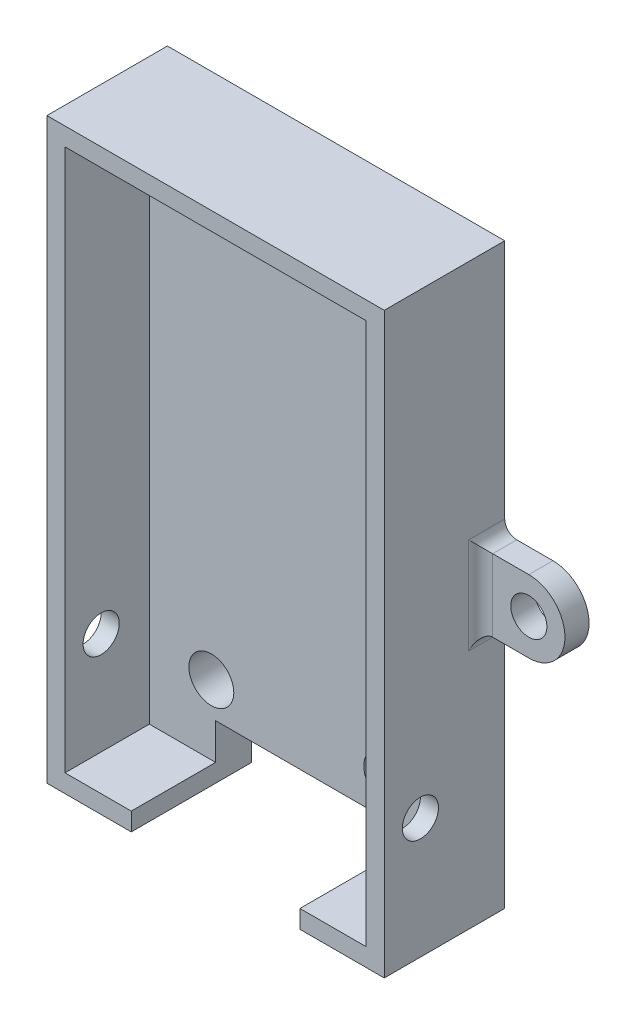
from build123d import *

# Parameters (mm, degrees)
ESQUISSE1_W                  = 25
ESQUISSE1_H                  = 45
ESQUISSE1_R                  = 1.863501178
ESQUISSE1_R_2                = 1.93430269
ESQUISSE1_R_3                = 1.939737899
ESQUISSE1_R_4                = 1.854627201
BOSS_EXTRU_1_DEPTH           = 3
BOSS_EXTRU_2_DEPTH           = 10
ENL_V_MAT_EXTRU_1_DEPTH      = 30.52964612
ENL_V_MAT_EXTRU_1_DEPTH_BACK = 30.52964612
ESQUISSE3_R                  = 1.5
ESQUISSE4_R                  = 1.5
BOSS_EXTRU_3_DEPTH           = 2
CONG_1_R                     = 1
ESQUISSE5_W                  = 14
ESQUISSE5_H                  = 3
ENL_V_MAT_EXTRU_2_DEPTH      = 34.421549934


with BuildPart() as part:
    # Esquisse1 → Boss.-Extru.1 (new body)
    with BuildSketch(Plane.XY):
        Rectangle(ESQUISSE1_W, ESQUISSE1_H)
        with Locations((-7.354431697, -16.736502833)):
            Circle(ESQUISSE1_R, mode=Mode.SUBTRACT)
        with Locations((7.237211302, -16.593743463)):
            Circle(ESQUISSE1_R_2, mode=Mode.SUBTRACT)
        with Locations((-7.142905367, 18.055953642)):
            Circle(ESQUISSE1_R_3, mode=Mode.SUBTRACT)
        with Locations((7.324743745, 18.008545284)):
            Circle(ESQUISSE1_R_4, mode=Mode.SUBTRACT)
    extrude(amount=BOSS_EXTRU_1_DEPTH)

    # Esquisse2 → Boss.-Extru.2 (add)
    with BuildSketch(Plane.XY):
        Polygon((7, -22.5), (7, -24), (14, -24), (14, 24), (-14, 24), (-14, -24), (-7, -24), (-7, -22.5), (-12.5, -22.5), (-12.5, 22.5), (12.5, 22.5), (12.5, -22.5), align=None)
    extrude(amount=BOSS_EXTRU_2_DEPTH)

    # Esquisse3 → Enlèv. mat.-Extru.1 (cut, two sides: drawn at the far end of the back side and taken through both)
    with BuildSketch(Plane(origin=(0, 0, 0), x_dir=(0, 0, -1), z_dir=(1, 0, 0)).offset(-ENL_V_MAT_EXTRU_1_DEPTH_BACK)):
        with Locations((-7, -14)):
            Circle(ESQUISSE3_R)
    extrude(amount=ENL_V_MAT_EXTRU_1_DEPTH + ENL_V_MAT_EXTRU_1_DEPTH_BACK, mode=Mode.SUBTRACT)

    # Esquisse4 → Boss.-Extru.3 (add)
    # profile 1 of 2: a face of its own
    with BuildSketch(Plane.XY):
        with BuildLine():
            Line((-14, 3), (-18, 3))
            ThreePointArc((-18, 3), (-21, 0), (-18, -3))
            Line((-18, -3), (-14, -3))
            Line((-14, -3), (-14, 3))
        make_face()
        with Locations((-18, 0)):
            Circle(ESQUISSE4_R, mode=Mode.SUBTRACT)
    # profile 2 of 2: a face of its own
    with BuildSketch(Plane.XY):
        with BuildLine():
            Line((18, -3), (14, -3))
            Line((14, -3), (14, 3))
            Line((14, 3), (18, 3))
            ThreePointArc((18, 3), (21, 0), (18, -3))
        make_face()
        with Locations(Location((18, 0, 0), (0, 0, 180))):
            Circle(ESQUISSE4_R, mode=Mode.SUBTRACT)
    extrude(amount=BOSS_EXTRU_3_DEPTH)

    # Congé1
    cong_1_edges = [part.edges().sort_by_distance(p)[0] for p in [
        (-14, 0, 2),
        (-14, -3, 1),
        (-14, 3, 1),
        (14, 0, 2),
        (14, 3, 1),
        (14, -3, 1),
    ]]
    fillet(cong_1_edges, radius=CONG_1_R)

    # Esquisse5 → Enlèv. mat.-Extru.2 (cut, through all)
    with BuildSketch(Plane.XY):
        with Locations((0, -21)):
            Rectangle(ESQUISSE5_W, ESQUISSE5_H)
    extrude(amount=ENL_V_MAT_EXTRU_2_DEPTH, mode=Mode.SUBTRACT)


solid = part.part
